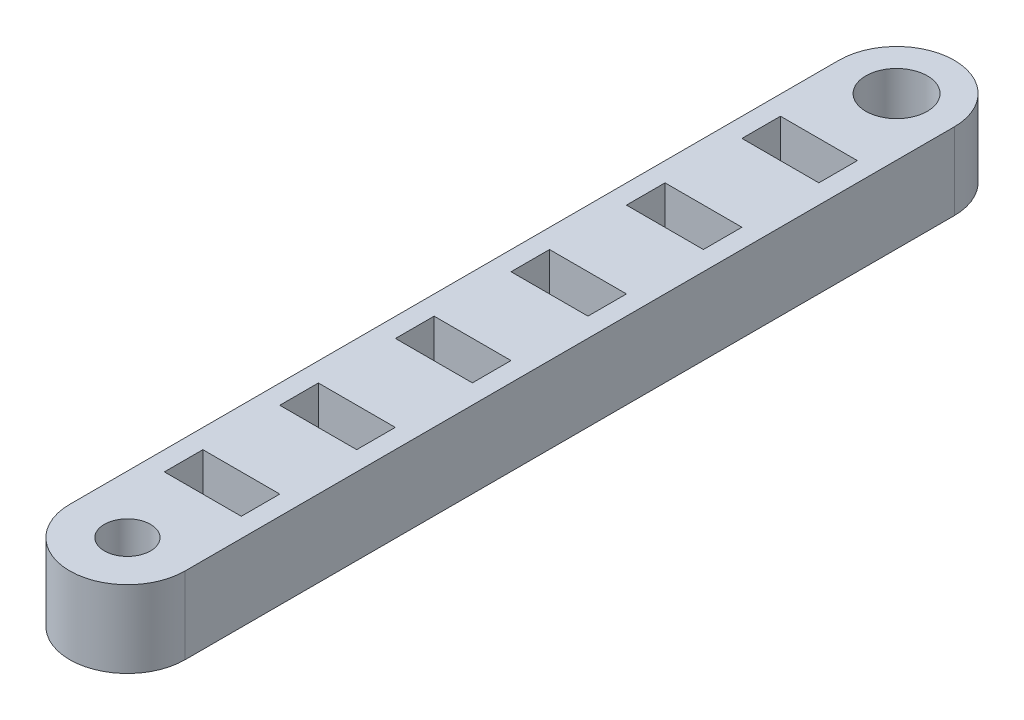
from build123d import *

# Parameters (mm, degrees)
BOSS_EXTRUDE1_DEPTH = 10
SKETCH8_R           = 4
CUT_EXTRUDE3_DEPTH  = 22
SKETCH14_R          = 3
CUT_EXTRUDE4_DEPTH  = 20


with BuildPart() as part:
    # Sketch1 → Boss-Extrude1 (new body)
    with BuildSketch(Plane(origin=(0, 0, 0), x_dir=(1, 0, 0), z_dir=(0, 1, 0))):
        with BuildLine():
            Line((12.93082957, 63.664368909), (12.93082957, -36.335631091))
            ThreePointArc((12.93082957, -36.335631091), (5.43082957, -43.835631091), (-2.06917043, -36.335631091))
            Line((-2.06917043, -36.335631091), (-2.06917043, 63.664368909))
            ThreePointArc((-2.06917043, 63.664368909), (5.43082957, 71.164368909), (12.93082957, 63.664368909))
        make_face()
    extrude(amount=BOSS_EXTRUDE1_DEPTH)

    # Sketch8 → Cut-Extrude3 (cut)
    with BuildSketch(Plane(origin=(0, 10, 0), x_dir=(1, 0, 0), z_dir=(0, 1, 0))):
        with Locations(Location((5.43082957, 63.664368909, 0), (0, 0, 270))):
            Circle(SKETCH8_R)
    extrude(amount=-CUT_EXTRUDE3_DEPTH, mode=Mode.SUBTRACT)

    # Sketch14 → Cut-Extrude4 (cut)
    with BuildSketch(Plane(origin=(0, 10, 0), x_dir=(1, 0, 0), z_dir=(0, 1, 0))):
        with Locations(Location((5.43082957, -36.335631091, 0), (0, 0, 270))):
            Circle(SKETCH14_R)
        Polygon((5.43082957, -21.527160564), (0.43082957, -21.527160564), (0.43082957, -26.531436495), (10.43082957, -26.531436495), (10.43082957, -21.527160564), align=None)
        Polygon((5.43082957, -6.509842668), (0.43082957, -6.509842668), (0.43082957, -11.527160564), (10.43082957, -11.527160564), (10.43082957, -6.509842668), align=None)
        Polygon((5.43082957, 8.538652281), (0.43082957, 8.538652281), (0.43082957, 3.51261249), (10.43082957, 3.51261249), (10.43082957, 8.538652281), align=None)
        Polygon((5.43082957, 23.544543967), (0.43082957, 23.544543967), (0.43082957, 18.538652281), (10.43082957, 18.538652281), (10.43082957, 23.544543967), align=None)
        Polygon((5.43082957, 38.56092778), (0.43082957, 38.56092778), (0.43082957, 33.544543967), (10.43082957, 33.544543967), (10.43082957, 38.56092778), align=None)
        Polygon((5.43082957, 53.568533881), (0.43082957, 53.568533881), (0.43082957, 48.56092778), (10.43082957, 48.56092778), (10.43082957, 53.568533881), align=None)
    extrude(amount=-CUT_EXTRUDE4_DEPTH, mode=Mode.SUBTRACT)


solid = part.part
